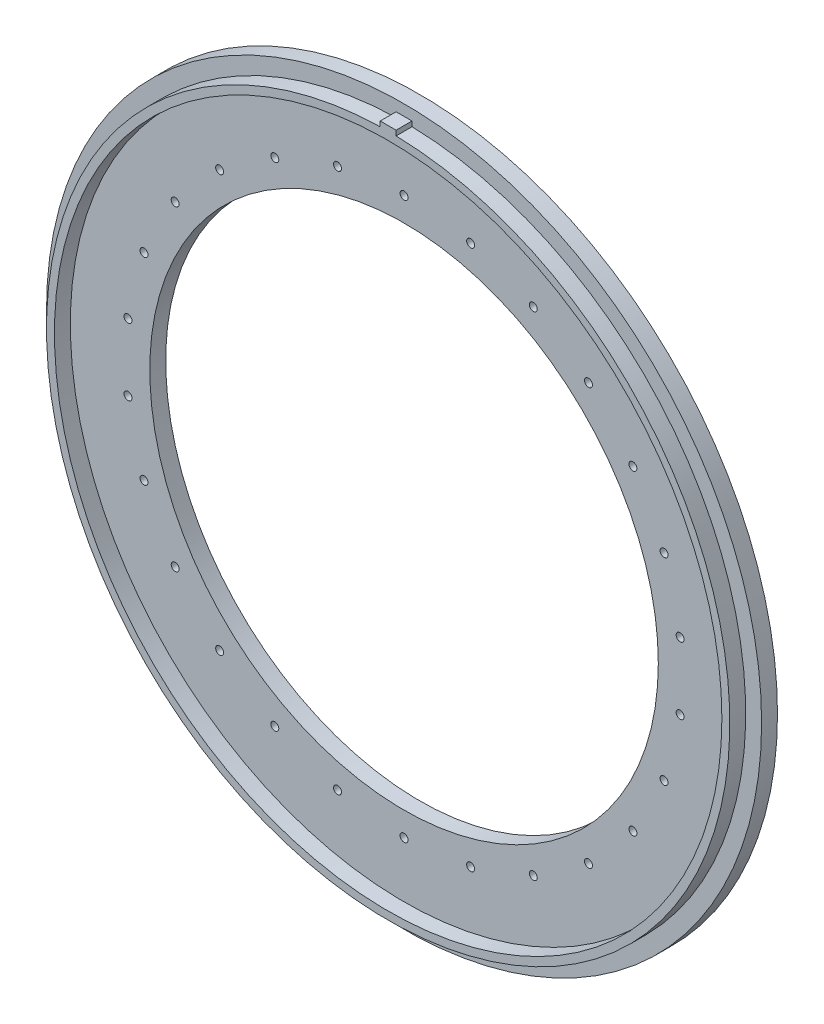
from build123d import *

# Parameters (mm, degrees)
SKETCH1_R           = 45
BOSS_EXTRUDE1_DEPTH = 2
SKETCH2_R           = 42
BOSS_EXTRUDE2_DEPTH = 2
SKETCH3_R           = 0.5
SKETCH3_R_2         = 32
CUT_EXTRUDE1_DEPTH  = 64.671029519


with BuildPart() as part:
    # Sketch1 → Boss-Extrude1 (new body)
    with BuildSketch(Plane.XY):
        Circle(SKETCH1_R)
    extrude(amount=BOSS_EXTRUDE1_DEPTH)

    # Sketch2 → Boss-Extrude2 (add)
    with BuildSketch(Plane.XY.offset(2)):
        with BuildLine():
            Line((-1, 43.617499368), (1, 43.617499368))
            Line((1, 43.617499368), (1, 42.98837052))
            ThreePointArc((1, 42.98837052), (0, -43), (-1, 42.98837052))
            Line((-1, 42.98837052), (-1, 43.617499368))
        make_face()
        Circle(SKETCH2_R, mode=Mode.SUBTRACT)
    extrude(amount=BOSS_EXTRUDE2_DEPTH)

    # Sketch3 → Cut-Extrude1 (cut, through all)
    with BuildSketch(Plane.XY.offset(2)):
        with Locations((0, 35)):
            Circle(SKETCH3_R)
        with Locations((8.37604825, 33.98296361)):
            Circle(SKETCH3_R)
        with Locations((16.265311022, 30.990960898)):
            Circle(SKETCH3_R)
        with Locations((23.209293038, 26.197876186)):
            Circle(SKETCH3_R)
        with Locations((28.804435306, 19.882266136)):
            Circle(SKETCH3_R)
        with Locations((32.725568494, 12.411171046)):
            Circle(SKETCH3_R)
        with Locations((34.744810593, 4.218783809)):
            Circle(SKETCH3_R)
        with Locations((34.744810593, -4.218783809)):
            Circle(SKETCH3_R)
        with Locations((32.725568494, -12.411171046)):
            Circle(SKETCH3_R)
        with Locations((28.804435306, -19.882266136)):
            Circle(SKETCH3_R)
        with Locations((23.209293038, -26.197876186)):
            Circle(SKETCH3_R)
        with Locations((16.265311022, -30.990960898)):
            Circle(SKETCH3_R)
        with Locations((8.37604825, -33.98296361)):
            Circle(SKETCH3_R)
        with Locations((0, -35)):
            Circle(SKETCH3_R)
        with Locations((-8.37604825, -33.98296361)):
            Circle(SKETCH3_R)
        with Locations((-16.265311022, -30.990960898)):
            Circle(SKETCH3_R)
        with Locations((-23.209293038, -26.197876186)):
            Circle(SKETCH3_R)
        with Locations((-28.804435306, -19.882266136)):
            Circle(SKETCH3_R)
        with Locations((-32.725568494, -12.411171046)):
            Circle(SKETCH3_R)
        with Locations((-34.744810593, -4.218783809)):
            Circle(SKETCH3_R)
        with Locations((-34.744810593, 4.218783809)):
            Circle(SKETCH3_R)
        with Locations((-32.725568494, 12.411171046)):
            Circle(SKETCH3_R)
        with Locations((-28.804435306, 19.882266136)):
            Circle(SKETCH3_R)
        with Locations((-23.209293038, 26.197876186)):
            Circle(SKETCH3_R)
        with Locations((-16.265311022, 30.990960898)):
            Circle(SKETCH3_R)
        with Locations((-8.37604825, 33.98296361)):
            Circle(SKETCH3_R)
        Circle(SKETCH3_R_2)
    extrude(amount=-CUT_EXTRUDE1_DEPTH, mode=Mode.SUBTRACT)


solid = part.part
